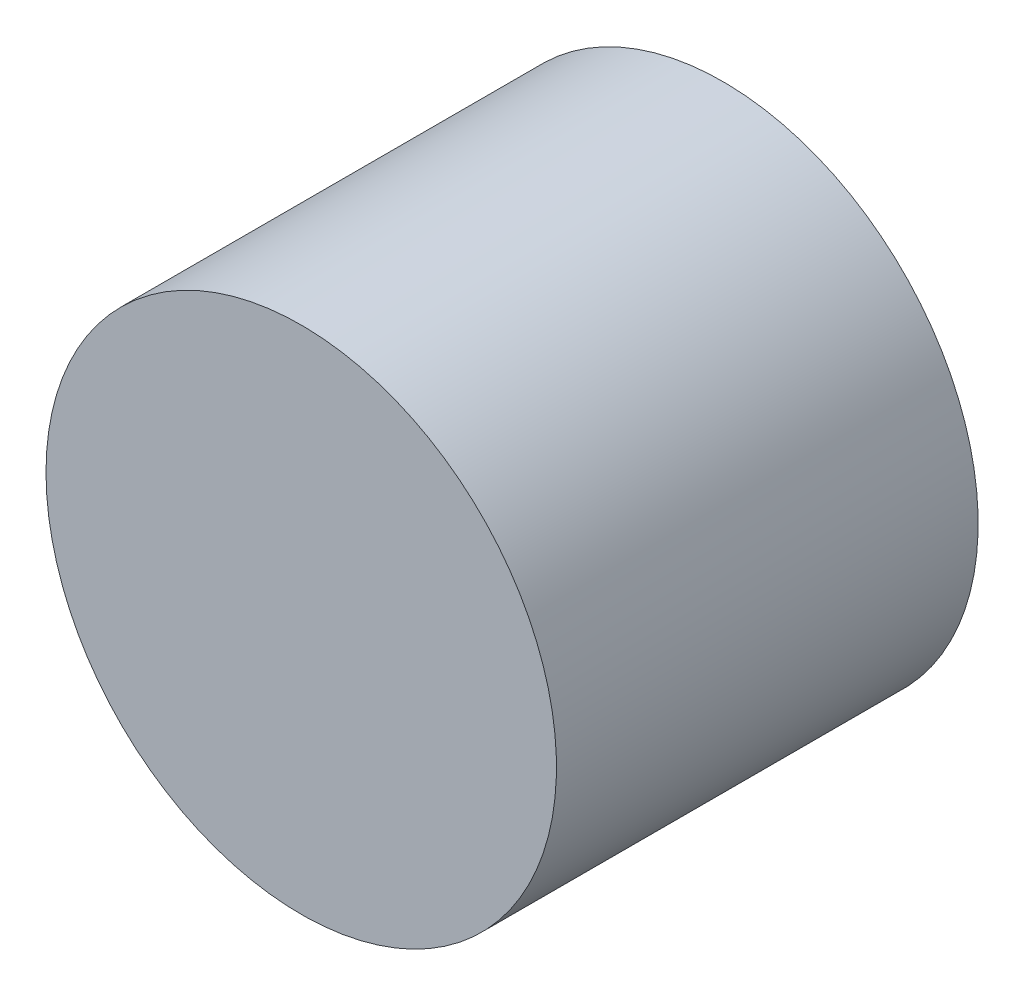
from build123d import *

# Parameters (mm, degrees)
SKETCH_2_R      = 2.3
EXTRUDE_1_DEPTH = 3.8


with BuildPart() as part:
    # Эскиз2 → Бобышка-Вытянуть1 (new body)
    with BuildSketch(Plane.XY):
        with Locations(Location((0, 0, 0), (0, 0, 180))):
            Circle(SKETCH_2_R)
    extrude(amount=EXTRUDE_1_DEPTH)


solid = part.part
